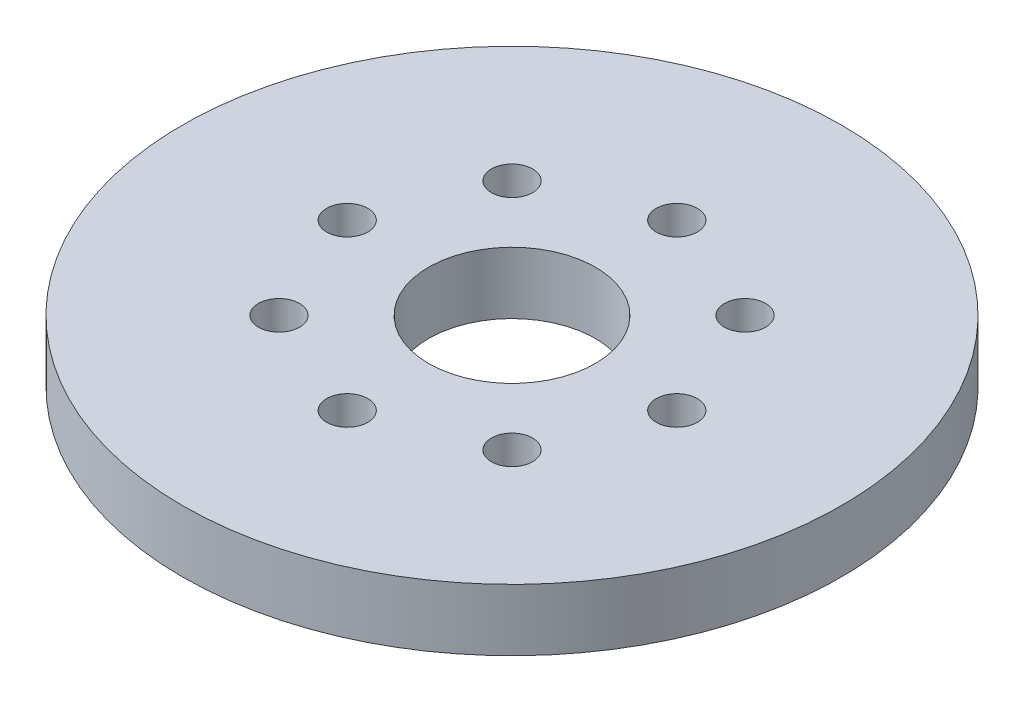
from build123d import *

# Parameters (mm, degrees)
SKETCH1_R           = 16
SKETCH1_R_2         = 4.05
SKETCH1_R_3         = 1
BOSS_EXTRUDE1_DEPTH = 3


with BuildPart() as part:
    # Sketch1 → Boss-Extrude1 (new body)
    with BuildSketch(Plane(origin=(0, 0, 0), x_dir=(1, 0, 0), z_dir=(0, 1, 0))):
        with Locations(Location((0, 0, 0), (0, 0, 270))):
            Circle(SKETCH1_R)
        with Locations(Location((0, 0, 0), (0, 0, 270))):
            Circle(SKETCH1_R_2, mode=Mode.SUBTRACT)
        with Locations(Location((0, 8, 0), (0, 0, 270))):
            Circle(SKETCH1_R_3, mode=Mode.SUBTRACT)
        with Locations(Location((5.656854249, 5.656854249, 0), (0, 0, 270))):
            Circle(SKETCH1_R_3, mode=Mode.SUBTRACT)
        with Locations(Location((8, 0, 0), (0, 0, 270))):
            Circle(SKETCH1_R_3, mode=Mode.SUBTRACT)
        with Locations(Location((5.656854249, -5.656854249, 0), (0, 0, 270))):
            Circle(SKETCH1_R_3, mode=Mode.SUBTRACT)
        with Locations(Location((0, -8, 0), (0, 0, 270))):
            Circle(SKETCH1_R_3, mode=Mode.SUBTRACT)
        with Locations(Location((-5.656854249, -5.656854249, 0), (0, 0, 270))):
            Circle(SKETCH1_R_3, mode=Mode.SUBTRACT)
        with Locations(Location((-8, 0, 0), (0, 0, 270))):
            Circle(SKETCH1_R_3, mode=Mode.SUBTRACT)
        with Locations(Location((-5.656854249, 5.656854249, 0), (0, 0, 270))):
            Circle(SKETCH1_R_3, mode=Mode.SUBTRACT)
    extrude(amount=BOSS_EXTRUDE1_DEPTH)


solid = part.part
